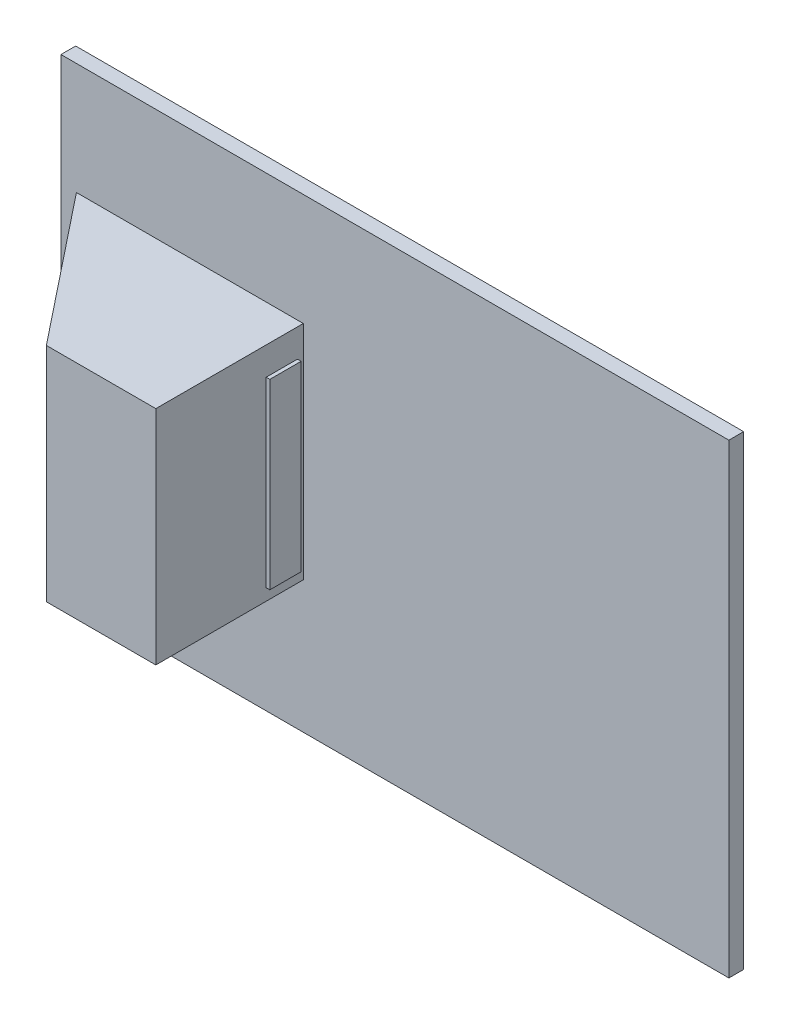
from build123d import *

# Parameters (mm, degrees)
SKETCH1_W            = 86.26612282
SKETCH1_H            = 57.862502499
BOSS_EXTRUDE1_DEPTH  = 5
SKETCH2_W            = 36.260872389
SKETCH2_H            = 45.239555314
SKETCH2_W_2          = 34.782772322
SKETCH2_H_2          = 43.550253841
BOSS_EXTRUDE2_DEPTH  = 1
SKETCH3_R            = 3.560103521
BOSS_EXTRUDE3_DEPTH  = 1
CUT_EXTRUDE2_DEPTH   = 0.5
CUT_EXTRUDE3_DEPTH   = 0.5
SKETCH11_W           = 90.581934504
SKETCH11_H           = 63.169878757
BOSS_EXTRUDE4_DEPTH  = 2
CUT_EXTRUDE11_DEPTH  = 101.321804273
CUT_EXTRUDE15_DEPTH  = 103.919917714
CUT_EXTRUDE18_DEPTH  = 107.173317368
CUT_EXTRUDE21_DEPTH  = 107.173317368
SKETCH22_W           = 30.768629045
SKETCH22_H           = 30.108187039
BOSS_EXTRUDE9_DEPTH  = 20
CUT_EXTRUDE25_DEPTH  = 30
SKETCH24_W           = 10.403591378
SKETCH24_H           = 24.347234515
CUT_EXTRUDE27_DEPTH  = 7
CUT_EXTRUDE29_DEPTH  = 101.055879455
BOSS_EXTRUDE12_DEPTH = 0.5
CUT_EXTRUDE30_DEPTH  = 0.5
SKETCH28_W           = 4.24318125
SKETCH28_H           = 24.719707094
BOSS_EXTRUDE13_DEPTH = 0.5
BOSS_EXTRUDE14_DEPTH = 0.5
BOSS_EXTRUDE15_DEPTH = 0.5
BOSS_EXTRUDE16_DEPTH = 0.5
BOSS_EXTRUDE17_DEPTH = 0.5
BOSS_EXTRUDE18_DEPTH = 0.5
BOSS_EXTRUDE19_DEPTH = 0.5


with BuildPart() as part:
    # Sketch1 → Boss-Extrude1 (new body)
    with BuildSketch(Plane.XY):
        with Locations((-40.563374765, -16.351878859)):
            Rectangle(SKETCH1_W, SKETCH1_H)
    extrude(amount=BOSS_EXTRUDE1_DEPTH)

    # Sketch2 → Boss-Extrude2 (add)
    with BuildSketch(Plane(origin=(0, 0, 0), x_dir=(-1, 0, 0), z_dir=(0, 0, -1))):
        with Locations((32.418116178, -15.92763049)):
            Rectangle(SKETCH2_W, SKETCH2_H)
        with Locations((32.418116178, -15.92763049)):
            Rectangle(SKETCH2_W_2, SKETCH2_H_2, mode=Mode.SUBTRACT)
    extrude(amount=BOSS_EXTRUDE2_DEPTH)

    # Sketch3 → Boss-Extrude3 (add)
    with BuildSketch(Plane(origin=(0, 0, 0), x_dir=(-1, 0, 0), z_dir=(0, 0, -1))):
        with Locations((5.84715491, -15.809376146)):
            Circle(SKETCH3_R)
    extrude(amount=BOSS_EXTRUDE3_DEPTH)

    # Sketch4 → Cut-Extrude2 (cut)
    with BuildSketch(Plane(origin=(0, 0, -1), x_dir=(-1, 0, 0), z_dir=(0, 0, -1))):
        with BuildLine():
            Line((7.498244586, -13.503730374), (7.429945817, -14.22683494))
            ThreePointArc((7.429945817, -14.22683494), (3.750240849, -15.79486572), (7.319195969, -17.600830429))
            Line((7.319195969, -17.600830429), (7.313770936, -18.341402976))
            ThreePointArc((7.313770936, -18.341402976), (3.134365244, -15.759677296), (7.498244586, -13.503730374))
        make_face()
    extrude(amount=-CUT_EXTRUDE2_DEPTH, mode=Mode.SUBTRACT)

    # Sketch5 → Cut-Extrude3 (cut)
    with BuildSketch(Plane(origin=(0, 0, -1), x_dir=(-1, 0, 0), z_dir=(0, 0, -1))):
        with BuildLine():
            Line((8.340052895, -15.49291333), (5.46397868, -15.438165983))
            ThreePointArc((5.46397868, -15.438165983), (5.066360432, -15.835784231), (5.46397868, -16.233402479))
            Line((5.46397868, -16.233402479), (8.340052895, -16.178655131))
            ThreePointArc((8.340052895, -16.178655131), (8.682923796, -15.835784231), (8.340052895, -15.49291333))
        make_face()
    extrude(amount=-CUT_EXTRUDE3_DEPTH, mode=Mode.SUBTRACT)

    # Sketch11 → Boss-Extrude4 (add)
    with BuildSketch(Plane.XY.offset(5)):
        with Locations((-39.758075886, -16.772300036)):
            Rectangle(SKETCH11_W, SKETCH11_H)
    extrude(amount=BOSS_EXTRUDE4_DEPTH)

    # Sketch12 → Cut-Extrude11 (cut, through all)
    with BuildSketch(Plane(origin=(2.569686645, 0, 0), x_dir=(0, 0, -1), z_dir=(1, 0, 0))):
        Polygon((-5.049502584, 12.555506791), (1.376837193, 8.637811028), (1.49491418, 17.884962826), align=None)
    extrude(amount=-CUT_EXTRUDE11_DEPTH, mode=Mode.SUBTRACT)

    # Sketch14 → Cut-Extrude15 (cut, through all)
    with BuildSketch(Plane.ZY.offset(85.049043138)):
        Polygon((5, -45.234938719), (-1.330755584, -41.178219973), (-1.62330097, -49.506029315), align=None)
    extrude(amount=-CUT_EXTRUDE15_DEPTH, mode=Mode.SUBTRACT)

    # Sketch15 → Cut-Extrude18 (cut, through all)
    with BuildSketch(Plane(origin=(0, -48.357239414, 0), x_dir=(-1, 0, 0), z_dir=(0, -1, 0))):
        Polygon((-2.559600043, -5), (1.778800488, 1.23954643), (-4.071250311, 1.127548689), align=None)
    extrude(amount=-CUT_EXTRUDE18_DEPTH, mode=Mode.SUBTRACT)

    # Sketch19 → Cut-Extrude21 (cut, through all)
    with BuildSketch(Plane(origin=(0, -48.357239414, 0), x_dir=(-1, 0, 0), z_dir=(0, -1, 0))):
        Polygon((83.717221886, -5), (87.274615215, 1.645442207), (78.528738966, 2.746914443), align=None)
    extrude(amount=-CUT_EXTRUDE21_DEPTH, mode=Mode.SUBTRACT)

    # Sketch22 → Boss-Extrude9 (add)
    with BuildSketch(Plane.XY.offset(7)):
        with Locations((-67.568283815, -15.397372948)):
            Rectangle(SKETCH22_W, SKETCH22_H)
    extrude(amount=BOSS_EXTRUDE9_DEPTH)

    # Sketch23 → Cut-Extrude25 (cut)
    with BuildSketch(Plane(origin=(-55.481529523, 0, -37.15866109), x_dir=(-0.5564715507955287, 0, 0.8308666638848977), z_dir=(-0.8308666638848977, 0, -0.5564715507955287))):
        Polygon((50.703232917, -28.437980679), (50.703232917, -4.339059459), (35.739273575, -4.339059459), (35.739273575, -28.68631805), align=None)
    extrude(amount=-CUT_EXTRUDE25_DEPTH, mode=Mode.SUBTRACT)

    # Sketch24 → Cut-Extrude27 (cut)
    with BuildSketch(Plane(origin=(0, 0, 0), x_dir=(-1, 0, 0), z_dir=(0, 0, -1))):
        with Locations((59.023003448, -16.512676716)):
            Rectangle(SKETCH24_W, SKETCH24_H)
    extrude(amount=-CUT_EXTRUDE27_DEPTH, mode=Mode.SUBTRACT)

    # Sketch25 → Cut-Extrude29 (cut, through all)
    with BuildSketch(Plane(origin=(0, -30.451466467, 0), x_dir=(-1, 0, 0), z_dir=(0, -1, 0))):
        Polygon((67.027013916, -27), (82.952598337, -7), (82.952598337, -27), align=None)
    extrude(amount=-CUT_EXTRUDE29_DEPTH, mode=Mode.SUBTRACT)

    # Sketch26 → Boss-Extrude12 (add)
    with BuildSketch(Plane(origin=(-28.214906652, 0, 42.127625982), x_dir=(-0.8308666638848977, 0, -0.5564715507955287), z_dir=(0.5564715507955287, 0, -0.8308666638848977))):
        Polygon((54.706101089, -26.949653395), (51.419951496, -27.042584084), (49.198141766, -24.942981754), (49.113437408, -21.947725891), (51.378991837, -19.979195935), (54.37614932, -19.775708176), (56.786873834, -21.375630671), (56.786873834, -24.75229922), align=None)
    extrude(amount=BOSS_EXTRUDE12_DEPTH)

    # Sketch27 → Cut-Extrude30 (cut)
    with BuildSketch(Plane(origin=(-27.936670877, 0, 41.71219265), x_dir=(-0.8308666638848977, 0, -0.5564715507955287), z_dir=(0.5564715507955287, 0, -0.8308666638848977))):
        Polygon((54.464642231, -26.33422033), (51.646822703, -26.4613127), (49.783754686, -24.759052026), (49.783754686, -22.033008306), (51.488432075, -20.626662945), (54.098721897, -20.567022016), (56.163922733, -21.70417842), (56.231939561, -24.681054163), align=None)
        Polygon((54.320245459, -25.718387713), (51.727557218, -25.777626474), (50.570422247, -24.540605306), (50.46279432, -22.1543403), (51.442527772, -21.237877536), (54.013268601, -21.237877536), (55.47502107, -22.062626752), (55.47502107, -24.540605306), align=None, mode=Mode.SUBTRACT)
    extrude(amount=-CUT_EXTRUDE30_DEPTH, mode=Mode.SUBTRACT)

    # Sketch28 → Boss-Extrude13 (add)
    with BuildSketch(Plane(origin=(-52.183969292, 0, 0), x_dir=(0, 0, -1), z_dir=(1, 0, 0))):
        with Locations((-9.915871479, -16.49665709)):
            Rectangle(SKETCH28_W, SKETCH28_H)
    extrude(amount=BOSS_EXTRUDE13_DEPTH)

    # Sketch30 → Boss-Extrude14 (add)
    with BuildSketch(Plane(origin=(-28.214906652, 0, 42.127625982), x_dir=(-0.8308666638848977, 0, -0.5564715507955287), z_dir=(0.5564715507955287, 0, -0.8308666638848977))):
        Polygon((39.741026767, -18.492349299), (39.476828341, -15.476612632), (41.672730665, -13.439507353), (44.994030875, -13.095306184), (47.582491955, -14.918927739), (47.582491955, -17.556607895), (45.597127238, -19.83975674), (42.278609784, -20.13048076), align=None)
        Polygon((42.753379884, -19.557574971), (40.218706227, -17.915219157), (40.047543839, -15.618736631), (41.858148024, -13.995937648), (44.641069188, -13.700148309), (47.008575054, -15.234186828), (47.087554216, -17.346914718), (45.214668989, -19.374129151), align=None, mode=Mode.SUBTRACT)
    extrude(amount=BOSS_EXTRUDE14_DEPTH)

    # Sketch31 → Boss-Extrude15 (add)
    with BuildSketch(Plane(origin=(-28.214906652, 0, 42.127625982), x_dir=(-0.8308666638848977, 0, -0.5564715507955287), z_dir=(0.5564715507955287, 0, -0.8308666638848977))):
        Polygon((42.85789788, -19.001700764), (40.90866855, -17.709787086), (40.798341652, -15.935629124), (42.206204193, -14.486449171), (44.028704588, -14.267801356), (46.155315135, -15.677280073), (46.251412911, -17.222620661), (44.58854897, -18.934285698), align=None)
    extrude(amount=BOSS_EXTRUDE15_DEPTH)

    # Sketch33 → Boss-Extrude16 (add)
    with BuildSketch(Plane(origin=(-28.214906652, 0, 42.127625982), x_dir=(-0.8308666638848977, 0, -0.5564715507955287), z_dir=(0.5564715507955287, 0, -0.8308666638848977))):
        Polygon((53.503569389, -12.179269703), (50.351287483, -12.179269703), (48.150822578, -10.212614431), (48.150822578, -7.156142438), (50.250219673, -5.786553335), (53.503569389, -5.786553335), (55.514913089, -7.370681289), (55.514913089, -10.417427621), align=None)
        Polygon((53.503569389, -11.59284841), (50.538143227, -11.59284841), (48.742717543, -9.971115552), (48.610538492, -7.370681289), (50.250219673, -6.308712506), (53.323905545, -6.308712506), (54.966436414, -7.540309967), (54.966436414, -10.417427621), align=None, mode=Mode.SUBTRACT)
    extrude(amount=BOSS_EXTRUDE16_DEPTH)

    # Sketch34 → Boss-Extrude17 (add)
    with BuildSketch(Plane(origin=(-28.214906652, 0, 42.127625982), x_dir=(-0.8308666638848977, 0, -0.5564715507955287), z_dir=(0.5564715507955287, 0, -0.8308666638848977))):
        Polygon((53.106511072, -10.916807454), (50.797180111, -10.916807454), (49.238061899, -9.758322552), (49.238061899, -7.718326208), (50.364231741, -6.77238362), (52.930318743, -6.77238362), (54.187501686, -7.744761691), (54.187501686, -9.990459151), align=None)
    extrude(amount=BOSS_EXTRUDE17_DEPTH)

    # Sketch35 → Boss-Extrude18 (add)
    with BuildSketch(Plane(origin=(-28.214906652, 0, 42.127625982), x_dir=(-0.8308666638848977, 0, -0.5564715507955287), z_dir=(0.5564715507955287, 0, -0.8308666638848977))):
        Polygon((64.713370944, -17.120370272), (64.713370944, -13.869783651), (62.565543637, -12.261672552), (58.957871215, -12.261672552), (56.858934257, -14.201881127), (56.858934257, -17.199269417), (59.382404361, -19.10483149), (62.522856876, -19.10483149), align=None)
        Polygon((62.386871017, -18.403496889), (59.382404361, -18.403496889), (57.566572856, -17.046527562), (57.566572856, -14.531930934), (59.047082081, -12.865218622), (62.565543637, -12.865218622), (63.938145996, -13.890963189), (63.938145996, -16.937939256), align=None, mode=Mode.SUBTRACT)
    extrude(amount=BOSS_EXTRUDE18_DEPTH)

    # Sketch36 → Boss-Extrude19 (add)
    with BuildSketch(Plane(origin=(-28.214906652, 0, 42.127625982), x_dir=(-0.8308666638848977, 0, -0.5564715507955287), z_dir=(0.5564715507955287, 0, -0.8308666638848977))):
        Polygon((61.869690046, -17.496423291), (59.930784693, -17.496423291), (58.716123087, -16.695847313), (58.520049306, -14.729642376), (59.362877574, -13.450874134), (61.666468176, -13.450874134), (62.906032733, -14.267863494), (62.906032733, -16.375473551), align=None)
    extrude(amount=BOSS_EXTRUDE19_DEPTH)


solid = part.part
